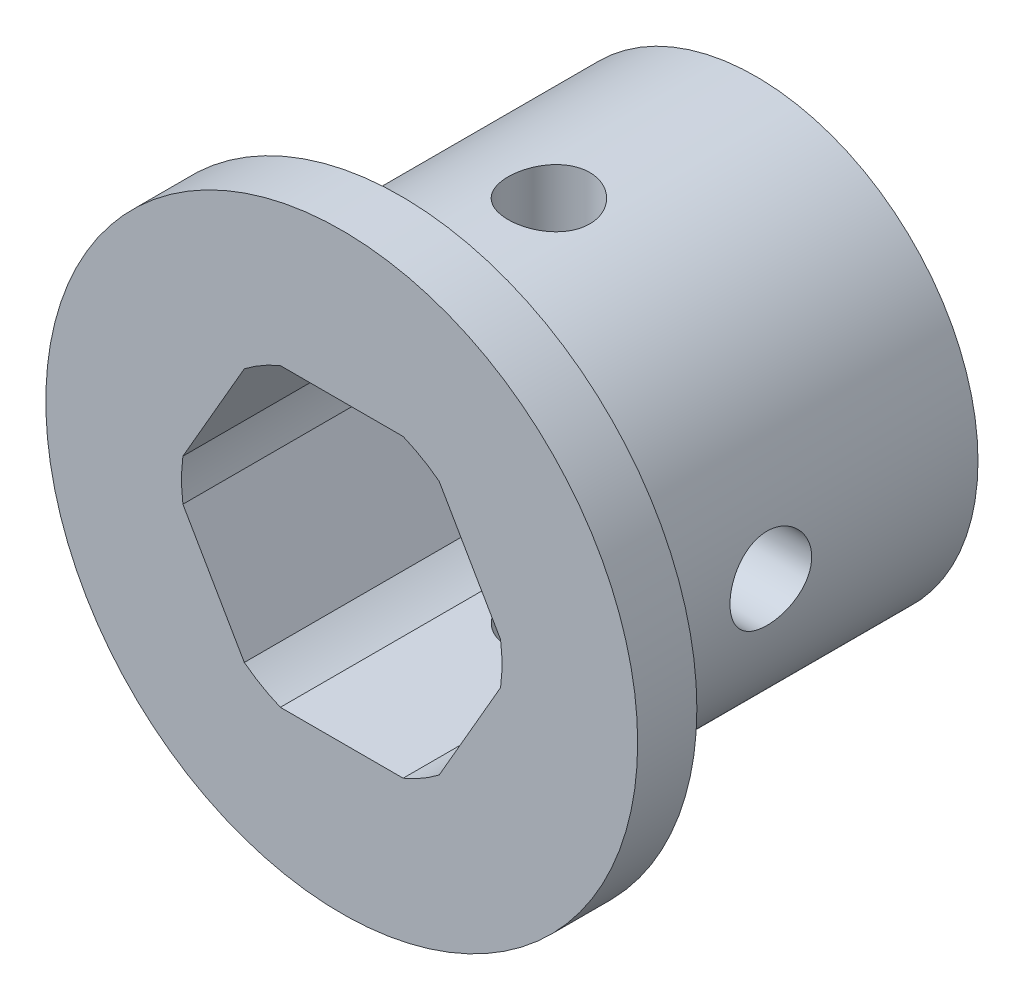
from build123d import *

# Parameters (mm, degrees)
SKETCH5_R               = 9.525
BOSS_EXTRUDE1_DEPTH     = 15.24
SKETCH6_R               = 12.7
BOSS_EXTRUDE2_DEPTH     = 2.54
CUT_EXTRUDE1_DEPTH      = 26.272680903
CUT_EXTRUDE3_DEPTH      = 26.272680903
CUT_EXTRUDE3_DEPTH_BACK = 26.272680903
SKETCH8_R               = 1.7526
CUT_EXTRUDE4_DEPTH      = 26.272680973
CUT_EXTRUDE4_DEPTH_BACK = 26.272680973
SKETCH9_R               = 1.7526


with BuildPart() as part:
    # Sketch5 → Boss-Extrude1 (new body)
    with BuildSketch(Plane.XY):
        with Locations(Location((0, 0, 0), (0, 0, 180))):
            Circle(SKETCH5_R)
    extrude(amount=BOSS_EXTRUDE1_DEPTH)

    # Sketch6 → Boss-Extrude2 (add)
    with BuildSketch(Plane.XY.offset(15.24)):
        Circle(SKETCH6_R)
    extrude(amount=BOSS_EXTRUDE2_DEPTH)

    # Sketch7 → Cut-Extrude1 (cut, through all)
    with BuildSketch(Plane(origin=(0, 0, 0), x_dir=(-1, 0, 0), z_dir=(0, 0, -1))):
        with BuildLine():
            ThreePointArc((4.181770846, 5.456960429), (3.437499983, 5.953924622), (2.634980936, 6.35))
            Line((2.634980936, 6.35), (-2.634980936, 6.35))
            ThreePointArc((-2.634980936, 6.35), (-3.437499983, 5.953924622), (-4.181770846, 5.456960429))
            Line((-4.181770846, 5.456960429), (-6.816751782, 0.893039571))
            ThreePointArc((-6.816751782, 0.893039571), (-6.874999966, 0), (-6.816751782, -0.893039571))
            Line((-6.816751782, -0.893039571), (-4.181770846, -5.456960429))
            ThreePointArc((-4.181770846, -5.456960429), (-3.437499983, -5.953924622), (-2.634980936, -6.35))
            Line((-2.634980936, -6.35), (2.634980936, -6.35))
            ThreePointArc((2.634980936, -6.35), (3.437499983, -5.953924622), (4.181770846, -5.456960429))
            Line((4.181770846, -5.456960429), (6.816751782, -0.893039571))
            ThreePointArc((6.816751782, -0.893039571), (6.860422465, -0.447468582), (6.874999966, 0))
            ThreePointArc((6.874999966, 0), (6.860422465, 0.447468582), (6.816751782, 0.893039571))
            Line((6.816751782, 0.893039571), (4.181770846, 5.456960429))
        make_face()
    extrude(amount=-CUT_EXTRUDE1_DEPTH, mode=Mode.SUBTRACT)

    # Sketch8 → Cut-Extrude3 (cut, two sides: drawn at the far end of the back side and taken through both)
    with BuildSketch(Plane(origin=(0, 0, 0), x_dir=(0, 0, -1), z_dir=(1, 0, 0)).offset(-CUT_EXTRUDE3_DEPTH_BACK)):
        with Locations((-8.89, 0)):
            Circle(SKETCH8_R)
    extrude(amount=CUT_EXTRUDE3_DEPTH + CUT_EXTRUDE3_DEPTH_BACK, mode=Mode.SUBTRACT)

    # Sketch9 → Cut-Extrude4 (cut, two sides: drawn at the far end of the back side and taken through both)
    with BuildSketch(Plane(origin=(0, 0, 0), x_dir=(1, 0, 0), z_dir=(0, 1, 0)).offset(-CUT_EXTRUDE4_DEPTH_BACK)):
        with Locations(Location((0, -8.89, 0), (0, 0, 270))):
            Circle(SKETCH9_R)
    extrude(amount=CUT_EXTRUDE4_DEPTH + CUT_EXTRUDE4_DEPTH_BACK, mode=Mode.SUBTRACT)


solid = part.part
